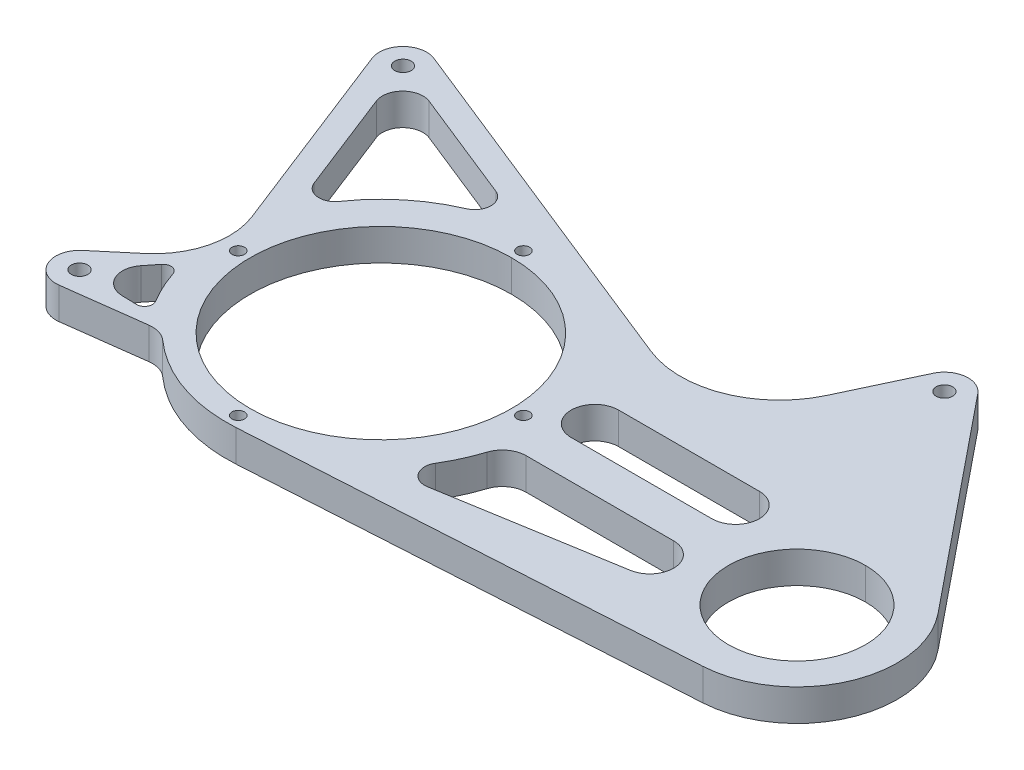
from build123d import *

# Parameters (mm, degrees)
SKETCH1_R             = 52.3875
SKETCH1_R_2           = 27.49999999
BOSS_EXTRUDE1_DEPTH   = 12.7
M6_CLEARANCE_HOLE1_D  = 6.6
F_5_0MM_DOWEL_HOLE1_D = 5
CIRPATTERN1_COUNT     = 4
CUT_EXTRUDE1_DEPTH    = 285.033029848
CUT_EXTRUDE2_DEPTH    = 285.033029848


with BuildPart() as part:
    # Sketch1 → Boss-Extrude1 (new body)
    with BuildSketch(Plane(origin=(0, 0, 0), x_dir=(1, 0, 0), z_dir=(0, 1, 0))):
        with BuildLine():
            Line((-207.974881785, -9.956762437), (-62.780706514, -68.14502812))
            ThreePointArc((-62.780706514, -68.14502812), (-33.518744337, -68.231765471), (-12.176603989, -48.212200061))
            Line((-12.176603989, -48.212200061), (1.412558245, -19.284326264))
            ThreePointArc((1.412558245, -19.284326264), (8.882880061, -13.878975143), (17.431697461, -17.334586496))
            Line((17.431697461, -17.334586496), (85.833023855, -101.678807679))
            ThreePointArc((85.833023855, -101.678807679), (91.405865058, -143.189636001), (57.036931176, -167.126674473))
            Line((57.036931176, -167.126674473), (-119.452254317, -177.801047868))
            ThreePointArc((-119.452254317, -177.801047868), (-143.500663307, -174.487669009), (-164.426538493, -162.182702446))
            ThreePointArc((-164.426538493, -162.182702446), (-168.164823601, -160.06920649), (-172.443362527, -159.700770109))
            Line((-172.443362527, -159.700770109), (-204.355245166, -163.82191268))
            ThreePointArc((-204.355245166, -163.82191268), (-214.295764489, -158.206433226), (-211.707233022, -147.086764223))
            Line((-211.707233022, -147.086764223), (-198.151371623, -135.681934472))
            ThreePointArc((-198.151371623, -135.681934472), (-188.283833694, -119.954004575), (-189.430137427, -101.422354045))
            Line((-189.430137427, -101.422354045), (-220.388836369, -22.267635732))
            ThreePointArc((-220.388836369, -22.267635732), (-218.225236723, -12.034965467), (-207.974881785, -9.956762437))
        make_face()
        with Locations(Location((-123.19, -116.001477372, 0), (0, 0, 270))):
            Circle(SKETCH1_R, mode=Mode.SUBTRACT)
        with Locations(Location((54.61, -127, 0), (0, 0, 270))):
            Circle(SKETCH1_R_2, mode=Mode.SUBTRACT)
    extrude(amount=BOSS_EXTRUDE1_DEPTH)

    # M6 Clearance Hole1 (through all)
    with Locations(Plane(origin=(0, 0, 0), x_dir=(-1, 0, 0), z_dir=(0, -1, 0))):
        with Locations((-10.033704867, -23.334197365), (211.518182886, -18.798178744), (205.575185514, -154.375359311)):
            Hole(M6_CLEARANCE_HOLE1_D / 2)

    # Ø5.0mm Dowel Hole1 (through all)
    with Locations(Plane(origin=(0, 0, 0), x_dir=(-1, 0, 0), z_dir=(0, -1, 0))):
        with Locations((123.19, -173.151477372)):
            f_5_0mm_dowel_hole1 = Hole(F_5_0MM_DOWEL_HOLE1_D / 2)

    # CirPattern1: Ø5.0mm Dowel Hole1 ×4 about axis
    cirpattern1_axis = Axis((-123.19, 0, 116.001477372), (0, 1, 0))
    for i in range(1, CIRPATTERN1_COUNT):
        add(f_5_0mm_dowel_hole1.rotate(cirpattern1_axis, i * 360 / CIRPATTERN1_COUNT), mode=Mode.SUBTRACT)

    # Sketch6 → Cut-Extrude1 (cut, through all)
    with BuildSketch(Plane.XZ):
        with BuildLine():
            ThreePointArc((-188.626913597, 77.326218823), (-183.343464985, 81.400582198), (-177.265672517, 78.648182362))
            ThreePointArc((-177.265672517, 78.648182362), (-164.864290964, 65.181201114), (-149.229324423, 55.657458697))
            ThreePointArc((-149.229324423, 55.657458697), (-145.319075006, 49.625624375), (-149.386073966, 43.698348841))
            Line((-149.386073966, 43.698348841), (-194.042740287, 25.801666969))
            ThreePointArc((-194.042740287, 25.801666969), (-202.810079512, 27.579196728), (-204.660650751, 36.331409888))
            Line((-204.660650751, 36.331409888), (-188.626913597, 77.326218823))
        make_face()
        with BuildLine():
            ThreePointArc((-194.692687992, 140.689511725), (-195.773357295, 149.809803058), (-188.096484537, 154.850952212))
            Line((-188.096484537, 154.850952212), (-182.142551509, 155.01295786))
            ThreePointArc((-182.142551509, 155.01295786), (-179.298484939, 153.425933155), (-179.332786017, 150.169219243))
            ThreePointArc((-179.332786017, 150.169219243), (-182.766707481, 143.751485155), (-185.46990532, 136.993390091))
            ThreePointArc((-185.46990532, 136.993390091), (-187.940827525, 134.871620657), (-190.985681304, 136.027573744))
            Line((-190.985681304, 136.027573744), (-194.692687992, 140.689511725))
        make_face()
    extrude(amount=-CUT_EXTRUDE1_DEPTH, mode=Mode.SUBTRACT)

    # Sketch7 → Cut-Extrude2 (cut, through all)
    with BuildSketch(Plane.XZ):
        with BuildLine():
            Line((-48.815667356, 114.096477372), (7.572332644, 114.096477372))
            ThreePointArc((7.572332644, 114.096477372), (17.097332644, 104.571477372), (7.572332644, 95.046477372))
            Line((7.572332644, 95.046477372), (-48.815667356, 95.046477372))
            ThreePointArc((-48.815667356, 95.046477372), (-58.340667356, 104.571477372), (-48.815667356, 114.096477372))
        make_face()
        with BuildLine():
            Line((-60.480063265, 159.980626251), (9.143311078, 148.338049571))
            ThreePointArc((9.143311078, 148.338049571), (17.064665217, 138.155302762), (7.572332644, 129.418495204))
            Line((7.572332644, 129.418495204), (-51.525154545, 129.418495204))
            ThreePointArc((-51.525154545, 129.418495204), (-57.140513894, 131.249772802), (-60.59665397, 136.039442314))
            ThreePointArc((-60.59665397, 136.039442314), (-63.415414116, 143.322639291), (-67.078188304, 150.220062883))
            ThreePointArc((-67.078188304, 150.220062883), (-66.914295931, 157.219714512), (-60.480063265, 159.980626251))
        make_face()
    extrude(amount=-CUT_EXTRUDE2_DEPTH, mode=Mode.SUBTRACT)


solid = part.part
